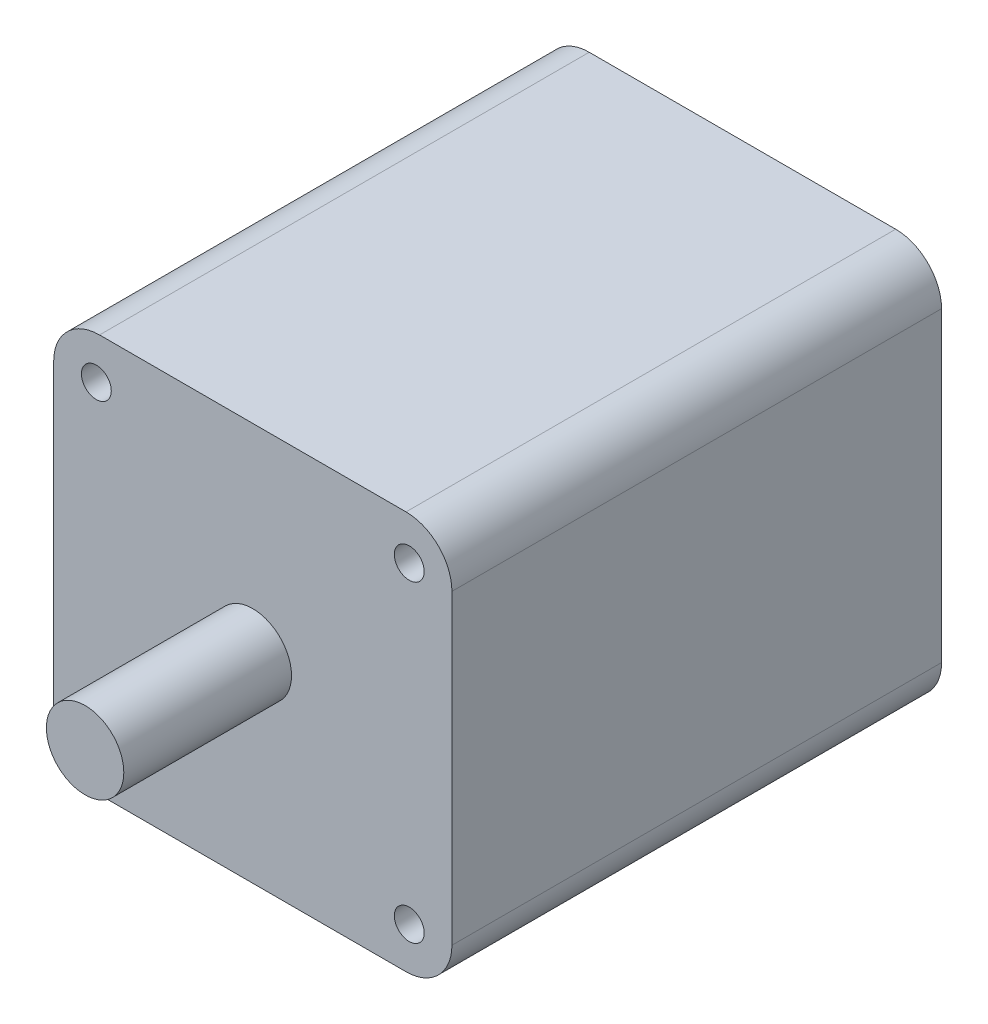
from build123d import *

# Parameters (mm, degrees)
EXTRUDE_1_DEPTH     = 221.3
SKETCH_2_R          = 17.5
EXTRUDE_2_DEPTH     = 75.8
SKETCH_3_R          = 6.75
CUT_EXTRUDE_1_DEPTH = 15


with BuildPart() as part:
    # 草图1 → 凸台-拉伸1 (new body)
    with BuildSketch(Plane.XY):
        with BuildLine():
            Line((-192.772466286, 112.972972973), (-54.254560741, 112.972972973))
            ThreePointArc((-54.254560741, 112.972972973), (-39.588425598, 106.898060889), (-33.513513514, 92.231925745))
            Line((-33.513513514, 92.231925745), (-33.513513514, -46.285979799))
            ThreePointArc((-33.513513514, -46.285979799), (-39.588425598, -60.952114943), (-54.254560741, -67.027027027))
            Line((-54.254560741, -67.027027027), (-192.772466286, -67.027027027))
            ThreePointArc((-192.772466286, -67.027027027), (-207.438601429, -60.952114943), (-213.513513514, -46.285979799))
            Line((-213.513513514, -46.285979799), (-213.513513514, 92.231925745))
            ThreePointArc((-213.513513514, 92.231925745), (-207.438601429, 106.898060889), (-192.772466286, 112.972972973))
        make_face()
    extrude(amount=EXTRUDE_1_DEPTH)

    # 草图2 → 凸台-拉伸2 (add)
    with BuildSketch(Plane.XY.offset(221.3)):
        with Locations((-123.513513514, 22.972972973)):
            Circle(SKETCH_2_R)
    extrude(amount=EXTRUDE_2_DEPTH)

    # 草图3 → 切除-拉伸1 (cut)
    with BuildSketch(Plane.XY.offset(221.3)):
        with Locations((-52.802835395, 93.683651092)):
            Circle(SKETCH_3_R)
        with Locations((-52.802835395, -47.737705146)):
            Circle(SKETCH_3_R)
        with Locations((-194.224191632, -47.737705146)):
            Circle(SKETCH_3_R)
        with Locations((-194.224191632, 93.683651092)):
            Circle(SKETCH_3_R)
    extrude(amount=-CUT_EXTRUDE_1_DEPTH, mode=Mode.SUBTRACT)


solid = part.part
